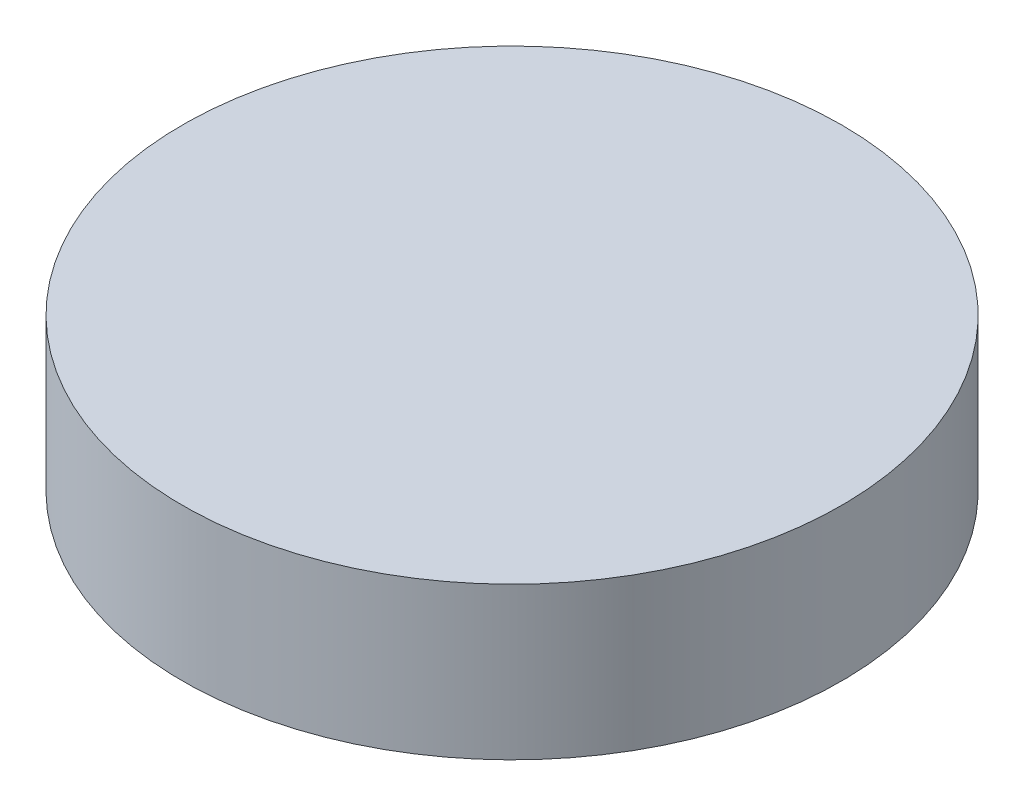
from build123d import *

# Parameters (mm, degrees)
SKETCH1_R           = 16.51
BOSS_EXTRUDE1_DEPTH = 7.62


with BuildPart() as part:
    # Sketch1 → Boss-Extrude1 (new body)
    with BuildSketch(Plane(origin=(0, 0, 0), x_dir=(1, 0, 0), z_dir=(0, 1, 0))):
        with Locations(Location((0, 0, 0), (0, 0, 90))):
            Circle(SKETCH1_R)
    extrude(amount=BOSS_EXTRUDE1_DEPTH)


solid = part.part
